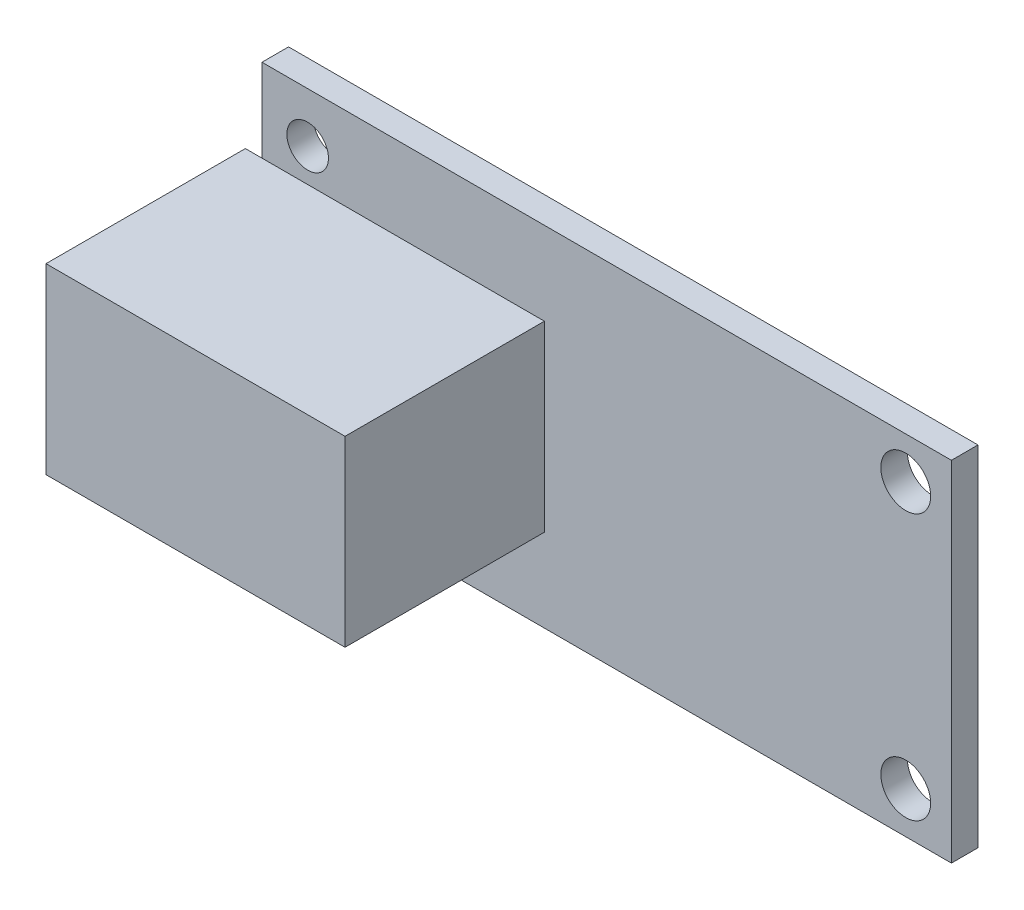
from build123d import *

# Parameters (mm, degrees)
SKETCH_1_W             = 41.5
SKETCH_1_H             = 21
EXTRUDE_346_DEPTH      = 1.6
SKETCH_2_W             = 18
SKETCH_2_H             = 11
RJ_9_DEPTH             = 12
SKETCH_3_R             = 1.25
SKETCH_3_R_2           = 1.5
CUT_EXTRUDE_1006_DEPTH = 27.968731895


with BuildPart() as part:
    # Эскиз1 → Extrude 346 (new body)
    with BuildSketch(Plane.XY):
        Rectangle(SKETCH_1_W, SKETCH_1_H)
    extrude(amount=EXTRUDE_346_DEPTH)

    # Эскиз2 → RJ-9 (add)
    with BuildSketch(Plane.XY.offset(1.6)):
        with Locations((-12.75, 0)):
            Rectangle(SKETCH_2_W, SKETCH_2_H)
    extrude(amount=RJ_9_DEPTH)

    # Эскиз3 → Cut-Extrude 1006 (cut, through all)
    with BuildSketch(Plane.XY.offset(1.6)):
        with Locations((-18, 7.5)):
            Circle(SKETCH_3_R)
        with Locations((18, 8)):
            Circle(SKETCH_3_R_2)
        with Locations(Location((18, -8, 0), (0, 0, 180))):
            Circle(SKETCH_3_R_2)
        with Locations(Location((-18, -7.5, 0), (0, 0, 180))):
            Circle(SKETCH_3_R)
    extrude(amount=-CUT_EXTRUDE_1006_DEPTH, mode=Mode.SUBTRACT)


solid = part.part
